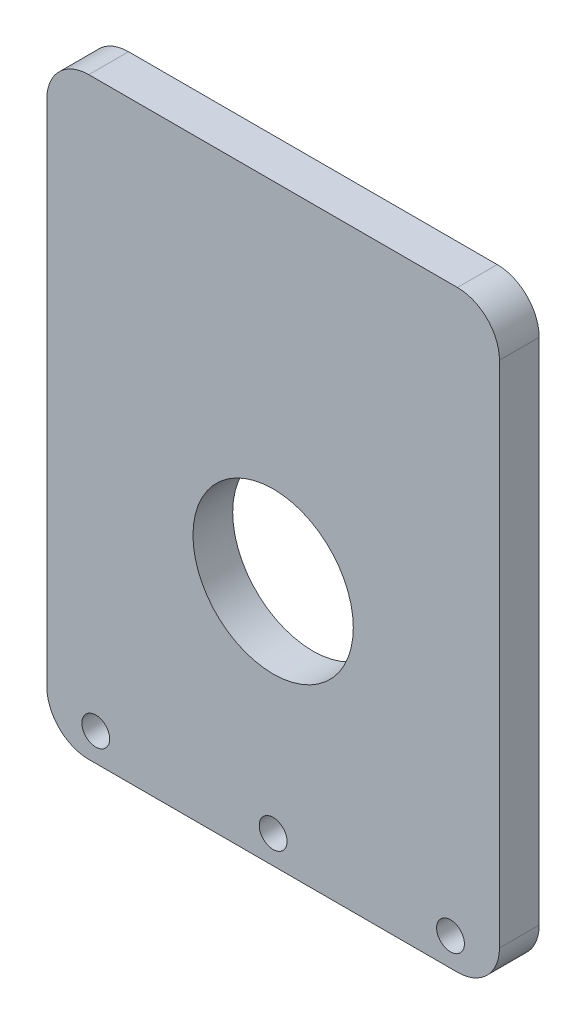
from build123d import *

# Parameters (mm, degrees)
SKETCH1_R           = 2.4892
SKETCH1_R_2         = 14.351
BOSS_EXTRUDE1_DEPTH = 7.112


with BuildPart() as part:
    # Sketch1 → Boss-Extrude1 (new body)
    with BuildSketch(Plane.XY):
        with BuildLine():
            Line((-4909.258266333, 2119.479597448), (-4843.269066333, 2119.479597448))
            ThreePointArc((-4843.269066333, 2119.479597448), (-4837.95275471, 2117.277509072), (-4835.750666333, 2111.961197448))
            Line((-4835.750666333, 2111.961197448), (-4835.750666333, 2020.838697448))
            ThreePointArc((-4835.750666333, 2020.838697448), (-4837.95275471, 2015.522385824), (-4843.269066333, 2013.320297448))
            Line((-4843.269066333, 2013.320297448), (-4909.258266333, 2013.320297448))
            ThreePointArc((-4909.258266333, 2013.320297448), (-4914.574577957, 2015.522385824), (-4916.776666333, 2020.838697448))
            Line((-4916.776666333, 2020.838697448), (-4916.776666333, 2111.961197448))
            ThreePointArc((-4916.776666333, 2111.961197448), (-4914.574577957, 2117.277509072), (-4909.258266333, 2119.479597448))
        make_face()
        with Locations((-4876.263666333, 2018.349497448)):
            Circle(SKETCH1_R, mode=Mode.SUBTRACT)
        with Locations((-4844.513666333, 2018.349497448)):
            Circle(SKETCH1_R, mode=Mode.SUBTRACT)
        with Locations((-4908.013666333, 2018.349497448)):
            Circle(SKETCH1_R, mode=Mode.SUBTRACT)
        with Locations((-4876.263666333, 2057.414697448)):
            Circle(SKETCH1_R_2, mode=Mode.SUBTRACT)
    extrude(amount=BOSS_EXTRUDE1_DEPTH)


solid = part.part
